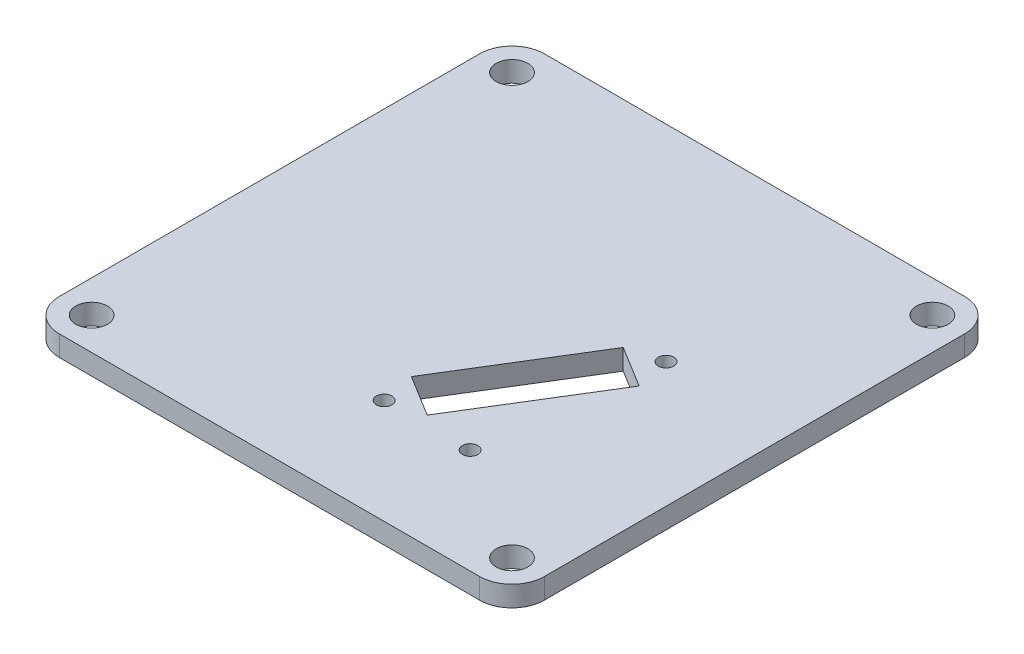
from build123d import *

# Parameters (mm, degrees)
BOSS_EXTRUDE1_DEPTH = 6.35
SKETCH2_R           = 2.4
SKETCH2_R_2         = 4.9
CUT_EXTRUDE1_DEPTH  = 213.227054119


with BuildPart() as part:
    # Sketch1 → Boss-Extrude1 (new body)
    with BuildSketch(Plane(origin=(0, 0, 0), x_dir=(1, 0, 0), z_dir=(0, 1, 0))):
        with BuildLine():
            Line((10, 0), (140, 0))
            ThreePointArc((140, 0), (147.071067812, 2.928932188), (150, 10))
            Line((150, 10), (150, 140))
            ThreePointArc((150, 140), (147.071067812, 147.071067812), (140, 150))
            Line((140, 150), (10, 150))
            ThreePointArc((10, 150), (2.928932188, 147.071067812), (0, 140))
            Line((0, 140), (0, 10))
            ThreePointArc((0, 10), (2.928932188, 2.928932188), (10, 0))
        make_face()
    extrude(amount=BOSS_EXTRUDE1_DEPTH)

    # Sketch2 → Cut-Extrude1 (cut, through all)
    with BuildSketch(Plane(origin=(0, 6.35, 0), x_dir=(1, 0, 0), z_dir=(0, 1, 0))):
        with Locations(Location((78.068159546, 32.4, 0), (0, 0, 270))):
            Circle(SKETCH2_R)
        with Locations(Location((104.650093785, 32.4, 0), (0, 0, 270))):
            Circle(SKETCH2_R)
        with Locations(Location((111.276700611, 86.369381637, 0), (0, 0, 270))):
            Circle(SKETCH2_R)
        with Locations(Location((10, 140, 0), (0, 0, 270))):
            Circle(SKETCH2_R_2)
        with Locations(Location((10, 10, 0), (0, 0, 270))):
            Circle(SKETCH2_R_2)
        with Locations(Location((140, 140, 0), (0, 0, 270))):
            Circle(SKETCH2_R_2)
        with Locations(Location((140, 10, 0), (0, 0, 270))):
            Circle(SKETCH2_R_2)
        Polygon((75.891616838, 42.983313926), (88.666849341, 35.122433917), (113.627763661, 75.688055524), (100.852531159, 83.548935532), align=None)
    extrude(amount=-CUT_EXTRUDE1_DEPTH, mode=Mode.SUBTRACT)


solid = part.part
